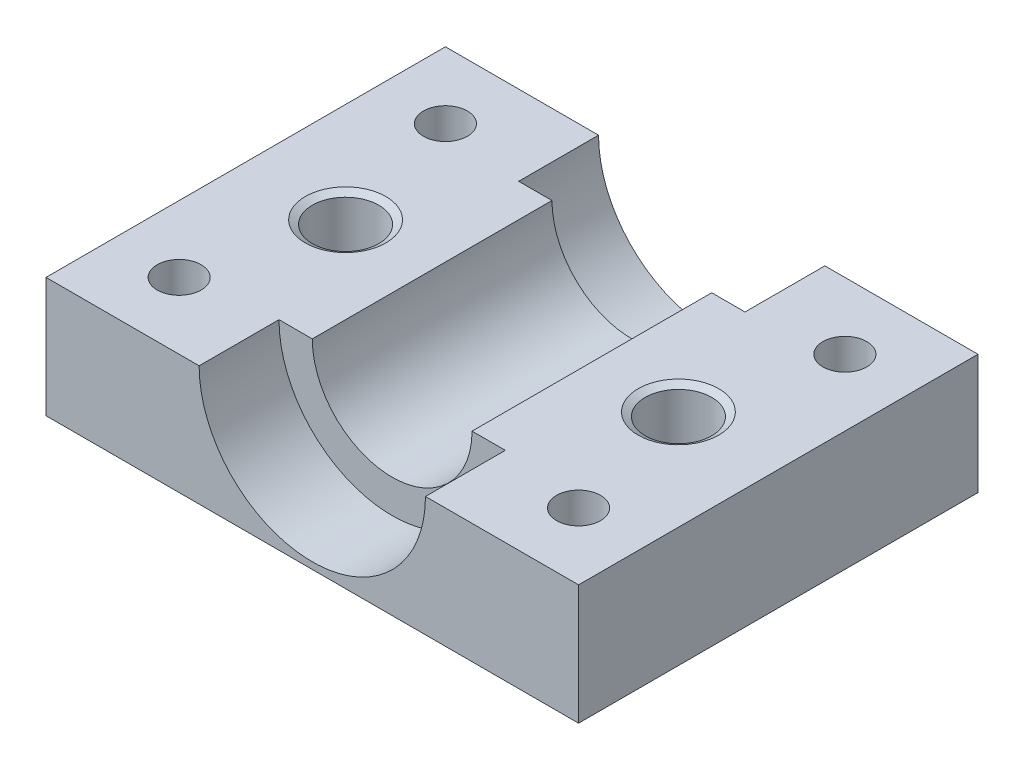
from build123d import *

# Parameters (mm, degrees)
EXTRUDE_1_DEPTH             = 24
EXTRUDE_1_DEPTH_BACK        = 6
EXTRUDE_2_DEPTH             = 18
HOLE_WIZARD_M41_D           = 3.3
HOLE_WIZARD_M41_DEPTH       = 11.5
HOLE_WIZARD_M41_CSINK_D     = 4.05
HOLE_WIZARD_M41_CSINK_ANGLE = 120
HOLE_WIZARD_M41_TIP         = 0.991420021
HOLE_WIZARD_M61_D           = 5
HOLE_WIZARD_M61_DEPTH       = 17
HOLE_WIZARD_M61_CSINK_D     = 6.05
HOLE_WIZARD_M61_CSINK_ANGLE = 120
HOLE_WIZARD_M61_TIP         = 1.502151548


with BuildPart() as part:
    # Эскиз1 → Бобышка-Вытянуть1 (new, two sides: drawn at the far end of the back side and taken through both)
    with BuildSketch(Plane.XY.offset(-EXTRUDE_1_DEPTH_BACK)):
        with BuildLine():
            Line((28.5, 9), (40, 9))
            Line((40, 9), (40, 0))
            Line((40, 0), (0, 0))
            Line((0, 0), (0, 9))
            Line((0, 9), (11.5, 9))
            ThreePointArc((11.5, 9), (20, 0.5), (28.5, 9))
        make_face()
    extrude(amount=EXTRUDE_1_DEPTH + EXTRUDE_1_DEPTH_BACK)

    # Эскиз3 → Бобышка-Вытянуть2 (add)
    with BuildSketch(Plane.XY):
        with BuildLine():
            Line((11.5, 9), (14, 9))
            ThreePointArc((14, 9), (20, 3), (26, 9))
            Line((26, 9), (28.5, 9))
            ThreePointArc((28.5, 9), (20, 0.5), (11.5, 9))
        make_face()
    extrude(amount=EXTRUDE_2_DEPTH)

    # Отверстие обработанное метчиком M41
    with Locations(Plane.XZ):
        with Locations((35, 19), (35, -1), (5, 19), (5, -1)):
            CounterSinkHole(HOLE_WIZARD_M41_D / 2, HOLE_WIZARD_M41_CSINK_D / 2, depth=HOLE_WIZARD_M41_DEPTH, counter_sink_angle=HOLE_WIZARD_M41_CSINK_ANGLE)
            with Locations((0, 0, -(HOLE_WIZARD_M41_DEPTH + HOLE_WIZARD_M41_TIP / 2))):  # 118° drill point
                Cone(0, HOLE_WIZARD_M41_D / 2, HOLE_WIZARD_M41_TIP, mode=Mode.SUBTRACT)

    # Отверстие обработанное метчиком M61
    with Locations(Plane(origin=(0, 9, 0), x_dir=(-1, 0, 0), z_dir=(0, 1, 0))):
        with Locations((-32.5, 9), (-7.5, 9)):
            CounterSinkHole(HOLE_WIZARD_M61_D / 2, HOLE_WIZARD_M61_CSINK_D / 2, depth=HOLE_WIZARD_M61_DEPTH, counter_sink_angle=HOLE_WIZARD_M61_CSINK_ANGLE)
            with Locations((0, 0, -(HOLE_WIZARD_M61_DEPTH + HOLE_WIZARD_M61_TIP / 2))):  # 118° drill point
                Cone(0, HOLE_WIZARD_M61_D / 2, HOLE_WIZARD_M61_TIP, mode=Mode.SUBTRACT)


solid = part.part
